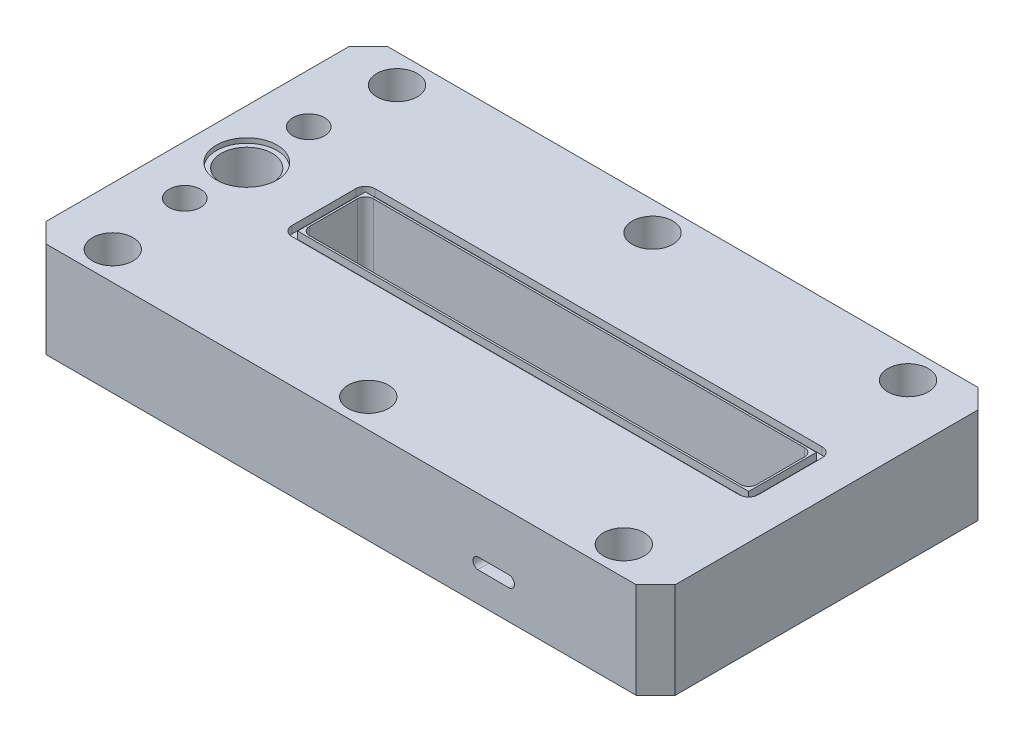
from build123d import *

# Parameters (mm, degrees)
SKETCH1_W            = 197
SKETCH1_H            = 107
BOSS_EXTRUDE1_DEPTH  = 30
SKETCH4_W            = 182
SKETCH4_H            = 45
CUT_EXTRUDE2_DEPTH   = 10
BOSS_EXTRUDE11_DEPTH = 10
CUT_EXTRUDE28_DEPTH  = 14.5
SKETCH9_R            = 8
CUT_EXTRUDE6_DEPTH   = 171
SKETCH10_R           = 9.5
CUT_EXTRUDE7_DEPTH   = 1.5
SKETCH11_R           = 4.95
CUT_EXTRUDE8_DEPTH   = 17.6
SKETCH41_R           = 2.9
CUT_EXTRUDE21_DEPTH  = 7
CUT_EXTRUDE22_DEPTH  = 10
CUT_EXTRUDE23_DEPTH  = 10
CUT_EXTRUDE29_DEPTH  = 14.5
CUT_EXTRUDE36_DEPTH  = 55.4
SKETCH90_R           = 6.35
CUT_EXTRUDE38_DEPTH  = 17
SKETCH91_W           = 141.2
SKETCH91_H           = 21.2
CUT_EXTRUDE39_DEPTH  = 2.3
CUT_EXTRUDE40_DEPTH  = 227.181343174


with BuildPart() as part:
    # Sketch1 → Boss-Extrude1 (new body)
    with BuildSketch(Plane(origin=(0, 0, 0), x_dir=(1, 0, 0), z_dir=(0, 1, 0))):
        with Locations((98.5, 53.5)):
            Rectangle(SKETCH1_W, SKETCH1_H)
    extrude(amount=BOSS_EXTRUDE1_DEPTH)

    # Sketch4 → Cut-Extrude2 (cut)
    with BuildSketch(Plane(origin=(0, 0, 0), x_dir=(1, 0, 0), z_dir=(0, 1, 0))):
        with Locations((98.5, 53.5)):
            Rectangle(SKETCH4_W, SKETCH4_H)
    extrude(amount=CUT_EXTRUDE2_DEPTH, mode=Mode.SUBTRACT)

    # Sketch53 → Boss-Extrude11 (add)
    with BuildSketch(Plane(origin=(0, 10, 0), x_dir=(-1, 0, 0), z_dir=(0, -1, 0))):
        Polygon((-7.5, 51), (-7.5, 31), (-38.5, 31), align=None)
        Polygon((-7.5, 56), (-7.5, 76), (-38.5, 76), align=None)
    extrude(amount=BOSS_EXTRUDE11_DEPTH)

    # Izq → Cut-Extrude28 (cut)
    with BuildSketch(Plane(origin=(0, 27.358390683, -11.62731604), x_dir=(1, 0, 0), z_dir=(0, 0.9203309184584746, -0.3911406403448515))):
        Polygon((7.5, 48.213835991), (38.5, 69.945149803), (7.5, 69.945149803), align=None)
    extrude(amount=-CUT_EXTRUDE28_DEPTH, mode=Mode.SUBTRACT)

    # Sketch9 → Cut-Extrude6 (cut)
    with BuildSketch(Plane(origin=(0, 30, 0), x_dir=(1, 0, 0), z_dir=(0, 1, 0))):
        with Locations(Location((15.45, 53.5, 0), (0, 0, 270))):
            Circle(SKETCH9_R)
    extrude(amount=-CUT_EXTRUDE6_DEPTH, mode=Mode.SUBTRACT)

    # Sketch10 → Cut-Extrude7 (cut)
    with BuildSketch(Plane(origin=(0, 30, 0), x_dir=(1, 0, 0), z_dir=(0, 1, 0))):
        with Locations(Location((15.45, 53.5, 0), (0, 0, 270))):
            Circle(SKETCH10_R)
    extrude(amount=-CUT_EXTRUDE7_DEPTH, mode=Mode.SUBTRACT)

    # Sketch11 → Cut-Extrude8 (cut)
    with BuildSketch(Plane(origin=(0, 30, 0), x_dir=(1, 0, 0), z_dir=(0, 1, 0))):
        with Locations(Location((15.45, 72.905102572, 0), (0, 0, 270))):
            Circle(SKETCH11_R)
        with Locations(Location((15.45, 34.094897428, 0), (0, 0, 270))):
            Circle(SKETCH11_R)
    extrude(amount=-CUT_EXTRUDE8_DEPTH, mode=Mode.SUBTRACT)

    # Sketch41 → Cut-Extrude21 (cut)
    with BuildSketch(Plane(origin=(0, 0, 0), x_dir=(1, 0, 0), z_dir=(0, 1, 0))):
        with Locations(Location((138.5, 9, 0), (0, 0, 90))):
            Circle(SKETCH41_R)
        with Locations(Location((138.5, 98, 0), (0, 0, 90))):
            Circle(SKETCH41_R)
    extrude(amount=CUT_EXTRUDE21_DEPTH, mode=Mode.SUBTRACT)

    # Sketch42 → Cut-Extrude22 (cut)
    with BuildSketch(Plane.XY):
        with BuildLine():
            Line((141.261527075, 12.77273886), (151, 12.77273886))
            ThreePointArc((151, 12.77273886), (152.77273886, 11), (151, 9.22726114))
            Line((151, 9.22726114), (141.261527075, 9.27273886))
            ThreePointArc((141.261527075, 9.27273886), (139.77273886, 11.02273886), (141.261527075, 12.77273886))
        make_face()
    extrude(amount=-CUT_EXTRUDE22_DEPTH, mode=Mode.SUBTRACT)

    # Sketch43 → Cut-Extrude23 (cut)
    with BuildSketch(Plane(origin=(0, 0, -107), x_dir=(-1, 0, 0), z_dir=(0, 0, -1))):
        with BuildLine():
            Line((-55.7, 12.8), (-46, 12.8))
            ThreePointArc((-46, 12.8), (-44.2, 11), (-46, 9.2))
            Line((-46, 9.2), (-55.7, 9.2))
            ThreePointArc((-55.7, 9.2), (-57.5, 11), (-55.7, 12.8))
        make_face()
    extrude(amount=-CUT_EXTRUDE23_DEPTH, mode=Mode.SUBTRACT)

    # Der → Cut-Extrude29 (cut)
    with BuildSketch(Plane(origin=(0, -11.159343568, -4.742721016), x_dir=(1, 0, 0), z_dir=(0, 0.9203309184584747, 0.3911406403448517))):
        Polygon((7.5, 50.261572284), (38.5, 28.530258472), (7.5, 28.530258472), align=None)
    extrude(amount=-CUT_EXTRUDE29_DEPTH, mode=Mode.SUBTRACT)

    # Sketch85 → Cut-Extrude36 (cut)
    with BuildSketch(Plane(origin=(0, 30, 0), x_dir=(1, 0, 0), z_dir=(0, 1, 0))):
        Polygon((0, 100.9), (6.1, 107), (0, 107), align=None)
        Polygon((0, 0), (6.1, 0), (0, 6.1), align=None)
        Polygon((197, 6.1), (190.9, 0), (197, 0), align=None)
        Polygon((197, 107), (190.9, 107), (197, 100.9), align=None)
    extrude(amount=-CUT_EXTRUDE36_DEPTH, mode=Mode.SUBTRACT)

    # Sketch90 → Cut-Extrude38 (cut)
    with BuildSketch(Plane(origin=(0, 30, 0), x_dir=(1, 0, 0), z_dir=(0, 1, 0))):
        with Locations(Location((18, 9, 0), (0, 0, 270))):
            Circle(SKETCH90_R)
        with Locations(Location((98, 9, 0), (0, 0, 270))):
            Circle(SKETCH90_R)
        with Locations(Location((178, 9, 0), (0, 0, 270))):
            Circle(SKETCH90_R)
        with Locations(Location((98, 98, 0), (0, 0, 270))):
            Circle(SKETCH90_R)
        with Locations(Location((178, 98, 0), (0, 0, 270))):
            Circle(SKETCH90_R)
        with Locations(Location((18, 98, 0), (0, 0, 270))):
            Circle(SKETCH90_R)
    extrude(amount=-CUT_EXTRUDE38_DEPTH, mode=Mode.SUBTRACT)

    # Sketch91 → Cut-Extrude39 (cut)
    with BuildSketch(Plane(origin=(0, 30, 0), x_dir=(1, 0, 0), z_dir=(0, 1, 0))):
        with BuildLine():
            Line((42.6, 66.5), (182.6, 66.5))
            ThreePointArc((182.6, 66.5), (184.721320344, 65.621320344), (185.6, 63.5))
            Line((185.6, 63.5), (185.6, 43.5))
            ThreePointArc((185.6, 43.5), (184.721320344, 41.378679656), (182.6, 40.5))
            Line((182.6, 40.5), (42.6, 40.5))
            ThreePointArc((42.6, 40.5), (40.478679656, 41.378679656), (39.6, 43.5))
            Line((39.6, 43.5), (39.6, 63.5))
            ThreePointArc((39.6, 63.5), (40.478679656, 65.621320344), (42.6, 66.5))
        make_face()
        with Locations((112.6, 53.5)):
            Rectangle(SKETCH91_W, SKETCH91_H, mode=Mode.SUBTRACT)
    extrude(amount=-CUT_EXTRUDE39_DEPTH, mode=Mode.SUBTRACT)

    # Sketch93 → Cut-Extrude40 (cut, through all)
    with BuildSketch(Plane(origin=(0, 30, 0), x_dir=(1, 0, 0), z_dir=(0, 1, 0))):
        with BuildLine():
            Line((45.1, 43.5), (180.1, 43.5))
            ThreePointArc((180.1, 43.5), (181.867766953, 44.232233047), (182.6, 46))
            Line((182.6, 46), (182.6, 61))
            ThreePointArc((182.6, 61), (181.867766953, 62.767766953), (180.1, 63.5))
            Line((180.1, 63.5), (45.1, 63.5))
            ThreePointArc((45.1, 63.5), (43.332233047, 62.767766953), (42.6, 61))
            Line((42.6, 61), (42.6, 46))
            ThreePointArc((42.6, 46), (43.332233047, 44.232233047), (45.1, 43.5))
        make_face()
    extrude(amount=-CUT_EXTRUDE40_DEPTH, mode=Mode.SUBTRACT)


solid = part.part
